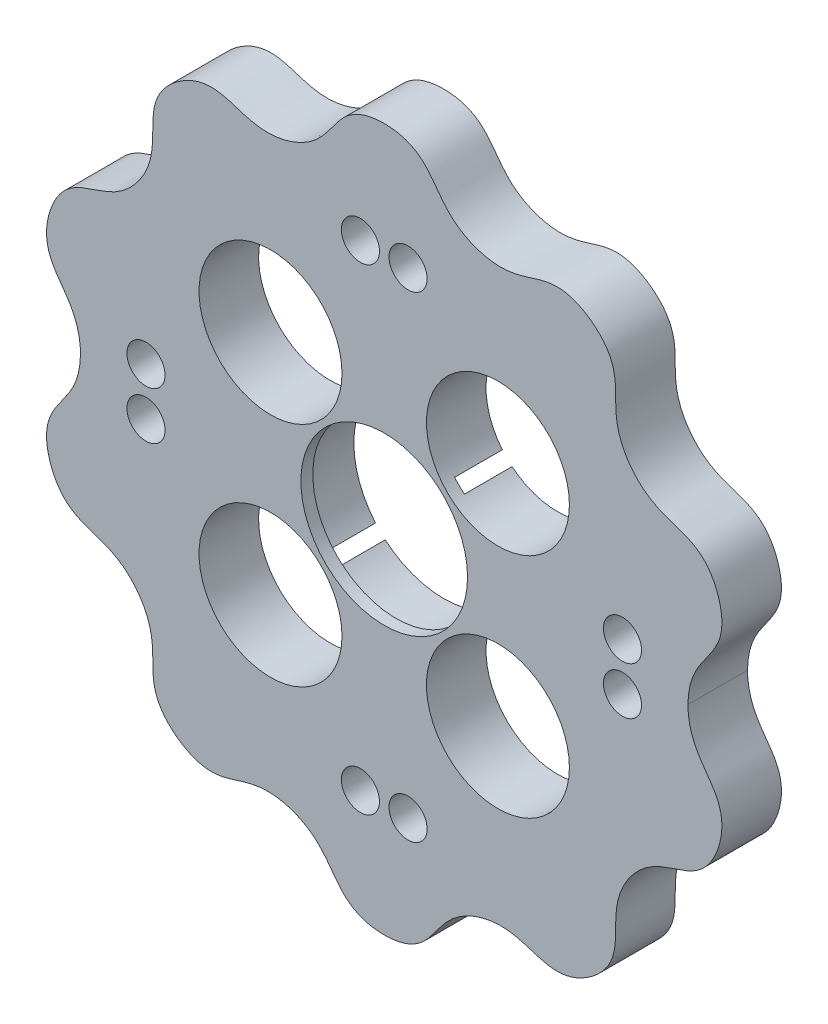
from build123d import *

# Parameters (mm, degrees)
SKETCH3_R                  = 7.5
CYC_DISK_DEPTH             = 5
SKETCH6_R                  = 7.55
CAM_BEARING_DEPTH          = 43.617229285
SKETCH8_R                  = 7.575
SKETCH8_R_2                = 6.995336342
CAM_BEARING_RETAINER_DEPTH = 1
SKETCH9_R                  = 1.6
POSITIONING_HOLES_DEPTH    = 43.617229285
SKETCH11_R                 = 6
OUTPUT_HOLES_DEPTH         = 43.617229285


with BuildPart() as part:
    # Sketch3 → CYC Disk (new body)
    with BuildSketch(Plane.XY.offset(4)):
        with BuildLine():
            add(Edge.make_bspline(
                [(-23.5, 0), (-23.500000004, -0.661850826), (-23.598485334, -1.456071804), (-23.887378462, -2.473353009), (-24.526473508, -3.480254489), (-25.323926988, -4.542764949), (-25.759943157, -5.192186221), (-26.203023639, -6.106999259), (-26.399245523, -6.974680154), (-26.368470738, -8.175748768), (-26.032181523, -9.410596043), (-25.46714701, -10.517898357), (-24.88950703, -11.225581762), (-23.980221887, -11.908283091), (-23.157605578, -12.27234585), (-21.75724169, -12.686961807), (-20.124240836, -13.267572581), (-18.769902135, -14.583261804), (-17.725881209, -16.190526715), (-17.393334278, -18.002161758), (-17.43929245, -19.341809491), (-17.428782036, -20.39238515), (-17.227121316, -21.51798755), (-16.875858121, -22.335292469), (-16.144990379, -23.288888425), (-15.147101673, -24.090235015), (-14.039123179, -24.653942451), (-13.15583675, -24.886942091), (-12.018927843, -24.904794671), (-11.139426548, -24.715805895), (-9.76280322, -24.22812401), (-8.100403327, -23.737994173), (-6.23137758, -24.006348799), (-4.442020297, -24.692993323), (-3.108131817, -25.963170679), (-2.357887579, -27.073981998), (-1.731871597, -27.917737693), (-0.907112157, -28.709835967), (-0.142534485, -29.16458221), (1.009259579, -29.506464264), (2.287588208, -29.568223008), (3.515300557, -29.373018486), (4.366848041, -29.042336417), (5.297120151, -28.388521169), (5.89756683, -27.718668148), (6.724626277, -26.514966324), (7.781444952, -25.141308816), (9.451253436, -24.259826499), (11.302473412, -23.763575766), (13.128203378, -24.007130856), (14.388082228, -24.464813592), (15.39048695, -24.779463326), (16.523315038, -24.935502855), (17.409164503, -24.853992814), (18.541938704, -24.453573642), (19.612429169, -23.752154799), (20.490930983, -22.872599811), (20.985477327, -22.104545345), (21.353780313, -21.028797471), (21.445822153, -20.13394129), (21.40740912, -18.673992713), (21.454977764, -16.941498013), (22.287758898, -15.246875037), (23.493738457, -13.75727996), (25.113943117, -12.881183019), (26.402225679, -12.510917922), (27.398134609, -12.176276192), (28.406329517, -11.63665518), (29.075086389, -11.05002292), (29.756159484, -10.060249035), (30.209920811, -8.863570763), (30.403654258, -7.63562542), (30.352299566, -6.723569256), (30.017954205, -5.636787881), (29.566434352, -4.858733188), (28.677221314, -3.700188592), (27.92348978, -2.600513359), (27.598485315, -1.456071829), (27.499999996, -0.661850826), (27.5, 0)],
                knots=[0.5, 0.5, 0.5, 0.5, 0.5, 0.5, 0.516666667, 0.52, 0.526666667, 0.53, 0.533333333, 0.536666667, 0.546666667, 0.55, 0.56, 0.563333333, 0.566666667, 0.57, 0.58, 0.583333333, 0.6, 0.61, 0.616666667, 0.626666667, 0.63, 0.633333333, 0.636666667, 0.646666667, 0.65, 0.66, 0.663333333, 0.666666667, 0.67, 0.68, 0.683333333, 0.7, 0.71, 0.716666667, 0.726666667, 0.73, 0.733333333, 0.736666667, 0.746666667, 0.75, 0.76, 0.763333333, 0.766666667, 0.77, 0.78, 0.783333333, 0.8, 0.81, 0.816666667, 0.826666667, 0.83, 0.833333333, 0.836666667, 0.846666667, 0.85, 0.86, 0.863333333, 0.866666667, 0.87, 0.88, 0.883333333, 0.9, 0.91, 0.916666667, 0.926666667, 0.93, 0.933333333, 0.936666667, 0.946666667, 0.95, 0.96, 0.963333333, 0.966666667, 0.97, 0.98, 0.983333333, 1, 1, 1, 1, 1, 1], degree=5, weights=[1, 1, 1, 1, 1, 1, 1, 1, 1, 1, 1, 1, 1, 1, 1, 1, 1, 1, 1, 1, 1, 1, 1, 1, 1, 1, 1, 1, 1, 1, 1, 1, 1, 1, 1, 1, 1, 1, 1, 1, 1, 1, 1, 1, 1, 1, 1, 1, 1, 1, 1, 1, 1, 1, 1, 1, 1, 1, 1, 1, 1, 1, 1, 1, 1, 1, 1, 1, 1, 1, 1, 1, 1, 1, 1, 1, 1, 1, 1, 1]))
            add(Edge.make_bspline(
                [(27.5, 0), (27.500000004, 0.661850826), (27.598485335, 1.456071804), (27.887378462, 2.473353009), (28.526473508, 3.480254489), (29.323926988, 4.542764949), (29.759943157, 5.192186221), (30.203023639, 6.106999259), (30.399245523, 6.974680154), (30.368470738, 8.175748768), (30.032181523, 9.410596043), (29.46714701, 10.517898357), (28.88950703, 11.225581762), (27.980221887, 11.908283091), (27.157605578, 12.27234585), (25.75724169, 12.686961807), (24.124240836, 13.267572581), (22.769902135, 14.583261804), (21.725881209, 16.190526715), (21.393334278, 18.002161758), (21.43929245, 19.341809491), (21.428782036, 20.39238515), (21.227121316, 21.51798755), (20.875858121, 22.335292469), (20.144990379, 23.288888425), (19.147101673, 24.090235015), (18.039123179, 24.653942451), (17.15583675, 24.886942091), (16.018927843, 24.904794671), (15.139426548, 24.715805895), (13.76280322, 24.22812401), (12.100403327, 23.737994173), (10.23137758, 24.006348799), (8.442020297, 24.692993323), (7.108131817, 25.963170679), (6.357887579, 27.073981998), (5.731871597, 27.917737693), (4.907112157, 28.709835967), (4.142534485, 29.16458221), (2.990740421, 29.506464264), (1.712411792, 29.568223008), (0.484699443, 29.373018486), (-0.366848041, 29.042336417), (-1.297120151, 28.388521169), (-1.89756683, 27.718668148), (-2.724626277, 26.514966324), (-3.781444952, 25.141308816), (-5.451253436, 24.259826499), (-7.302473412, 23.763575766), (-9.128203378, 24.007130856), (-10.388082228, 24.464813592), (-11.39048695, 24.779463326), (-12.523315038, 24.935502855), (-13.409164503, 24.853992814), (-14.541938704, 24.453573642), (-15.612429169, 23.752154799), (-16.490930983, 22.872599811), (-16.985477327, 22.104545345), (-17.353780313, 21.028797471), (-17.445822153, 20.13394129), (-17.40740912, 18.673992713), (-17.454977764, 16.941498013), (-18.287758898, 15.246875037), (-19.493738457, 13.75727996), (-21.113943117, 12.881183019), (-22.402225679, 12.510917922), (-23.398134609, 12.176276192), (-24.406329517, 11.63665518), (-25.075086389, 11.05002292), (-25.756159484, 10.060249035), (-26.209920811, 8.863570763), (-26.403654258, 7.63562542), (-26.352299566, 6.723569256), (-26.017954205, 5.636787881), (-25.566434352, 4.858733188), (-24.677221314, 3.700188592), (-23.92348978, 2.600513359), (-23.598485314, 1.456071829), (-23.499999996, 0.661850826), (-23.5, 0)],
                knots=[0, 0, 0, 0, 0, 0, 0.016666667, 0.02, 0.026666667, 0.03, 0.033333333, 0.036666667, 0.046666667, 0.05, 0.06, 0.063333333, 0.066666667, 0.07, 0.08, 0.083333333, 0.1, 0.11, 0.116666667, 0.126666667, 0.13, 0.133333333, 0.136666667, 0.146666667, 0.15, 0.16, 0.163333333, 0.166666667, 0.17, 0.18, 0.183333333, 0.2, 0.21, 0.216666667, 0.226666667, 0.23, 0.233333333, 0.236666667, 0.246666667, 0.25, 0.26, 0.263333333, 0.266666667, 0.27, 0.28, 0.283333333, 0.3, 0.31, 0.316666667, 0.326666667, 0.33, 0.333333333, 0.336666667, 0.346666667, 0.35, 0.36, 0.363333333, 0.366666667, 0.37, 0.38, 0.383333333, 0.4, 0.41, 0.416666667, 0.426666667, 0.43, 0.433333333, 0.436666667, 0.446666667, 0.45, 0.46, 0.463333333, 0.466666667, 0.47, 0.48, 0.483333333, 0.5, 0.5, 0.5, 0.5, 0.5, 0.5], degree=5, weights=[1, 1, 1, 1, 1, 1, 1, 1, 1, 1, 1, 1, 1, 1, 1, 1, 1, 1, 1, 1, 1, 1, 1, 1, 1, 1, 1, 1, 1, 1, 1, 1, 1, 1, 1, 1, 1, 1, 1, 1, 1, 1, 1, 1, 1, 1, 1, 1, 1, 1, 1, 1, 1, 1, 1, 1, 1, 1, 1, 1, 1, 1, 1, 1, 1, 1, 1, 1, 1, 1, 1, 1, 1, 1, 1, 1, 1, 1, 1, 1]))
        make_face()
        with Locations((2, 0)):
            Circle(SKETCH3_R, mode=Mode.SUBTRACT)
    extrude(amount=CYC_DISK_DEPTH)

    # Sketch6 → Cam Bearing (cut, through all)
    with BuildSketch(Plane.XY.offset(9)):
        with Locations((2, 0)):
            Circle(SKETCH6_R)
    extrude(amount=-CAM_BEARING_DEPTH, mode=Mode.SUBTRACT)

    # Sketch8 → Cam Bearing Retainer (add)
    with BuildSketch(Plane.XY.offset(9)):
        with Locations((2, 0)):
            Circle(SKETCH8_R)
        with Locations((2, 0)):
            Circle(SKETCH8_R_2, mode=Mode.SUBTRACT)
    extrude(amount=-CAM_BEARING_RETAINER_DEPTH)

    # Sketch9 → Positioning Holes (cut, through all)
    with BuildSketch(Plane.XY.offset(9)):
        with Locations((0, 20)):
            Circle(SKETCH9_R)
        with Locations((4, 20)):
            Circle(SKETCH9_R)
        with Locations((22, -2)):
            Circle(SKETCH9_R)
        with Locations((22, 2)):
            Circle(SKETCH9_R)
        with Locations((0, -20)):
            Circle(SKETCH9_R)
        with Locations((4, -20)):
            Circle(SKETCH9_R)
        with Locations((-18, 2)):
            Circle(SKETCH9_R)
        with Locations((-18, -2)):
            Circle(SKETCH9_R)
    extrude(amount=-POSITIONING_HOLES_DEPTH, mode=Mode.SUBTRACT)

    # Sketch11 → Output Holes (cut, through all)
    with BuildSketch(Plane.XY.offset(9)):
        with Locations((11.545941546, 9.545941546)):
            Circle(SKETCH11_R)
        with Locations((11.545941546, -9.545941546)):
            Circle(SKETCH11_R)
        with Locations((-7.545941546, -9.545941546)):
            Circle(SKETCH11_R)
        with Locations((-7.545941546, 9.545941546)):
            Circle(SKETCH11_R)
    extrude(amount=-OUTPUT_HOLES_DEPTH, mode=Mode.SUBTRACT)


solid = part.part
